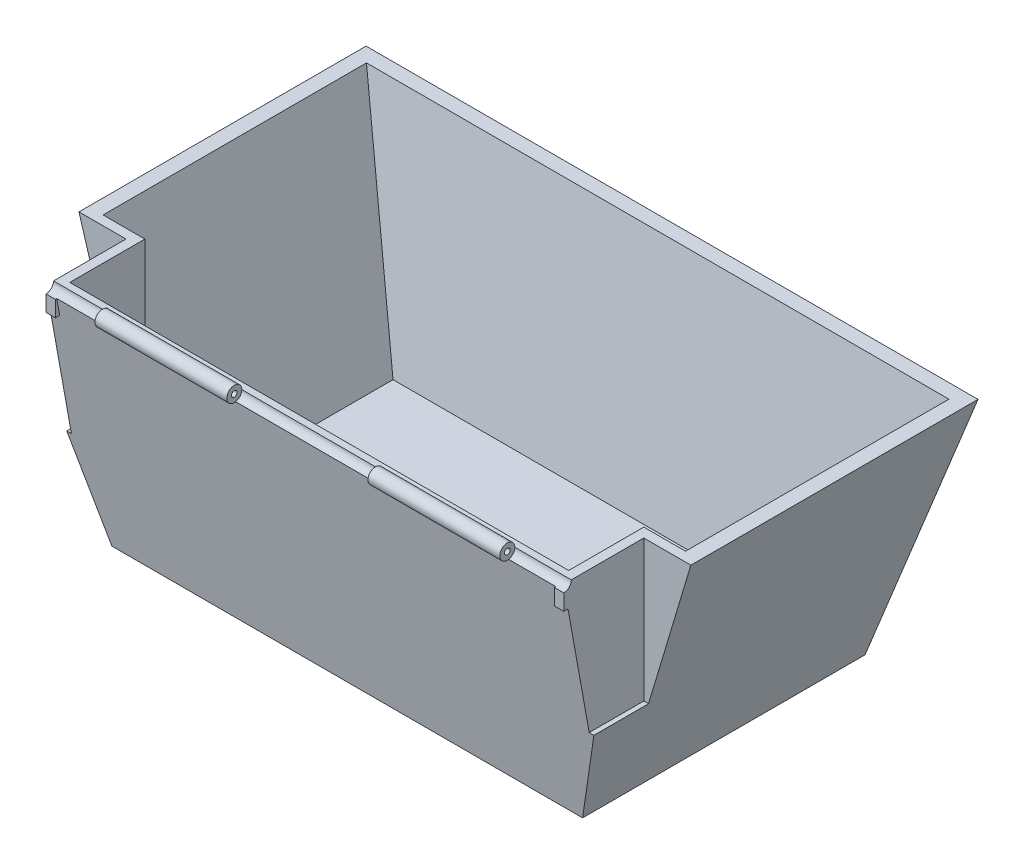
from build123d import *

# Parameters (mm, degrees)
SHELL_1_T                = -3
CUT_EXTRUDE_START        = 55
SKETCH_4_W               = 17
SKETCH_4_H               = 30
CUT_EXTRUDE_1_DEPTH      = 36.807488848
CUT_EXTRUDE_START_2      = -55
SKETCH_4_2_W             = 17
SKETCH_4_2_H             = 30
CUT_EXTRUDE_2_DEPTH      = 36.807488848
EXTRUDE_START            = 55
SKETCH_4_3_W             = 17
SKETCH_4_3_H             = 30
EXTRUDE_1_DEPTH          = 2
EXTRUDE_START_2          = -55
SKETCH_4_4_W             = 17
SKETCH_4_4_H             = 30
EXTRUDE_2_DEPTH          = 2
SKETCH_5_R               = 1.6
EXTRUDE_3_DEPTH          = 110
CUT_EXTRUDE_3_DEPTH      = 93.390042924
CUT_EXTRUDE_3_DEPTH_BACK = 93.390042924
SKETCH_5_3_R             = 0.6
CUT_EXTRUDE_4_DEPTH      = 15
CUT_EXTRUDE_4_DEPTH_BACK = 15
SKETCH_5_4_R             = 1.6
SKETCH_5_4_R_2           = 0.6
CUT_EXTRUDE_START_3      = -43
SKETCH_5_5_R             = 1.6
SKETCH_5_5_R_2           = 0.6
CUT_EXTRUDE_5_DEPTH      = 50.390042924
CUT_EXTRUDE_START_4      = 43
SKETCH_5_6_R             = 1.6
SKETCH_5_6_R_2           = 0.6
CUT_EXTRUDE_6_DEPTH      = 50.390042924
CUT_EXTRUDE_8_DEPTH      = 137.787865114
EXTRUDE_4_DEPTH          = 2


with BuildPart() as part:
    # 草图1 → 放样1 section 0
    with BuildSketch(Plane(origin=(0, 0, 0), x_dir=(1, 0, 0), z_dir=(0, 1, 0))):
        with BuildLine():
            Line((-50, -30), (50, -30))
            Line((50, -30), (50, 30))
            Line((50, 30), (-50, 30))
            Line((-50, 30), (-50, -30))
        make_face()
    # 草图2 → 放样1 section 1
    with BuildSketch(Plane(origin=(0, 50, 0), x_dir=(1, 0, 0), z_dir=(0, 1, 0))):
        with BuildLine():
            Line((-65, -39), (65, -39))
            Line((65, -39), (65, 39))
            Line((65, 39), (-65, 39))
            Line((-65, 39), (-65, -39))
        make_face()
    loft()

    # 抽壳1
    shell_1_openings = [part.faces().sort_by_distance(p)[0] for p in [
        (0, 50, 0),
    ]]
    offset(amount=SHELL_1_T, openings=shell_1_openings, kind=Kind.INTERSECTION)

    # 草图4 → 切除-拉伸1 (cut, through all)
    with BuildSketch(Plane(origin=(0, 0, 0), x_dir=(0, 0, -1), z_dir=(1, 0, 0)).offset(CUT_EXTRUDE_START)):
        with Locations((-30.5, 35)):
            Rectangle(SKETCH_4_W, SKETCH_4_H)
    extrude(amount=CUT_EXTRUDE_1_DEPTH, mode=Mode.SUBTRACT)

    # 草图4<2> → 切除-拉伸2 (cut, through all)
    with BuildSketch(Plane(origin=(0, 0, 0), x_dir=(0, 0, -1), z_dir=(1, 0, 0)).offset(CUT_EXTRUDE_START_2)):
        with Locations((-30.5, 35)):
            Rectangle(SKETCH_4_2_W, SKETCH_4_2_H)
    extrude(amount=-CUT_EXTRUDE_2_DEPTH, mode=Mode.SUBTRACT)

    # 草图4<3> → 凸台-拉伸1 (add)
    with BuildSketch(Plane(origin=(0, 0, 0), x_dir=(0, 0, -1), z_dir=(1, 0, 0)).offset(EXTRUDE_START)):
        with Locations((-30.5, 35)):
            Rectangle(SKETCH_4_3_W, SKETCH_4_3_H)
    extrude(amount=-EXTRUDE_1_DEPTH)

    # 草图4<4> → 凸台-拉伸2 (add)
    with BuildSketch(Plane(origin=(0, 0, 0), x_dir=(0, 0, -1), z_dir=(1, 0, 0)).offset(EXTRUDE_START_2)):
        with Locations((-30.5, 35)):
            Rectangle(SKETCH_4_4_W, SKETCH_4_4_H)
    extrude(amount=EXTRUDE_2_DEPTH)

    # 草图5 → 凸台-拉伸3 (add)
    with BuildSketch(Plane(origin=(0, 0, 0), x_dir=(0, 0, -1), z_dir=(1, 0, 0)).offset(EXTRUDE_START)):
        with Locations((-39, 50)):
            Circle(SKETCH_5_R)
    extrude(amount=-EXTRUDE_3_DEPTH)

    # 草图5<3> → 切除-拉伸3 (cut, two sides: drawn at the far end of the back side and taken through both)
    with BuildSketch(Plane(origin=(0, 0, 0), x_dir=(0, 0, -1), z_dir=(1, 0, 0)).offset(-CUT_EXTRUDE_3_DEPTH_BACK)):
        with Locations((-39, 50)):
            Circle(SKETCH_5_3_R)
    extrude(amount=CUT_EXTRUDE_3_DEPTH + CUT_EXTRUDE_3_DEPTH_BACK, mode=Mode.SUBTRACT)

    # 草图5<4> → 切除-拉伸4 (cut, two sides: drawn at the far end of the back side and taken through both)
    with BuildSketch(Plane(origin=(0, 0, 0), x_dir=(0, 0, -1), z_dir=(1, 0, 0)).offset(-CUT_EXTRUDE_4_DEPTH_BACK)):
        with Locations((-39, 50)):
            Circle(SKETCH_5_4_R)
        with Locations((-39, 50)):
            Circle(SKETCH_5_4_R_2, mode=Mode.SUBTRACT)
    extrude(amount=CUT_EXTRUDE_4_DEPTH + CUT_EXTRUDE_4_DEPTH_BACK, mode=Mode.SUBTRACT)

    # 草图5<5> → 切除-拉伸5 (cut, through all)
    with BuildSketch(Plane(origin=(0, 0, 0), x_dir=(0, 0, -1), z_dir=(1, 0, 0)).offset(CUT_EXTRUDE_START_3)):
        with Locations((-39, 50)):
            Circle(SKETCH_5_5_R)
        with Locations((-39, 50)):
            Circle(SKETCH_5_5_R_2, mode=Mode.SUBTRACT)
    extrude(amount=-CUT_EXTRUDE_5_DEPTH, mode=Mode.SUBTRACT)

    # 草图5<6> → 切除-拉伸6 (cut, through all)
    with BuildSketch(Plane(origin=(0, 0, 0), x_dir=(0, 0, -1), z_dir=(1, 0, 0)).offset(CUT_EXTRUDE_START_4)):
        with Locations((-39, 50)):
            Circle(SKETCH_5_6_R)
        with Locations((-39, 50)):
            Circle(SKETCH_5_6_R_2, mode=Mode.SUBTRACT)
    extrude(amount=CUT_EXTRUDE_6_DEPTH, mode=Mode.SUBTRACT)

    # 草图6 → 切除-拉伸8 (cut, through all)
    with BuildSketch(Plane(origin=(55, 0, 0), x_dir=(0, 0, -1), z_dir=(1, 0, 0))):
        Polygon((-39, 20), (-33.6, 20), (-38.1, 45), (-39, 45), align=None)
    extrude(amount=-CUT_EXTRUDE_8_DEPTH, mode=Mode.SUBTRACT)

    # 草图7 → 凸台-拉伸4 (add)
    with BuildSketch(Plane(origin=(0, 0, 22), x_dir=(-1, 0, 0), z_dir=(0, 0, -1))):
        Polygon((-65, 50), (-56, 20), (-53, 20), (-53, 50), align=None)
        Polygon((65, 50), (56, 20), (53, 20), (53, 50), align=None)
    extrude(amount=EXTRUDE_4_DEPTH)


solid = part.part
